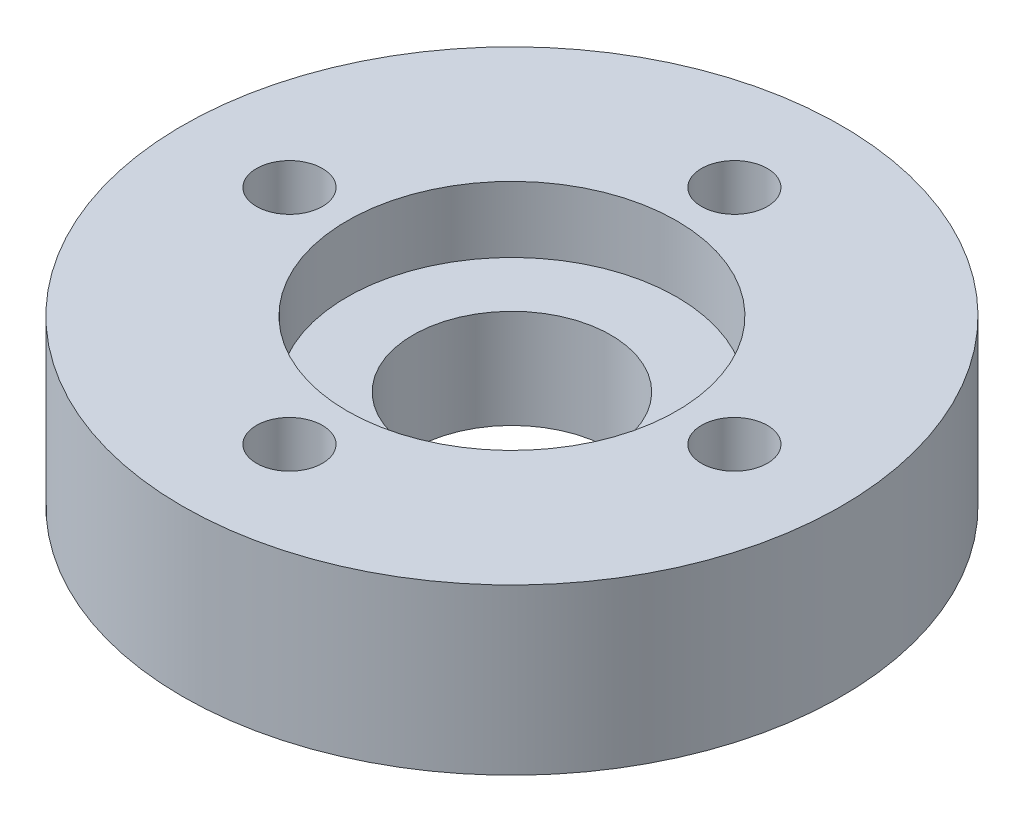
from build123d import *

# Parameters (mm, degrees)
SKETCH1_R           = 5
SKETCH1_R_2         = 3
BOSS_EXTRUDE1_DEPTH = 3
SKETCH1_3_R         = 10
SKETCH1_3_R_2       = 5
BOSS_EXTRUDE2_DEPTH = 5
BOSS_EXTRUDE3_START = 3
SKETCH1_4_R         = 1
BOSS_EXTRUDE3_DEPTH = 2


with BuildPart() as part:
    # Sketch1 → Boss-Extrude1 (new body)
    with BuildSketch(Plane(origin=(0, 0, 0), x_dir=(1, 0, 0), z_dir=(0, 1, 0))):
        Circle(SKETCH1_R)
        Circle(SKETCH1_R_2, mode=Mode.SUBTRACT)
    extrude(amount=BOSS_EXTRUDE1_DEPTH)

    # Sketch1<3> → Boss-Extrude2 (add)
    with BuildSketch(Plane(origin=(0, 0, 0), x_dir=(1, 0, 0), z_dir=(0, 1, 0))):
        Circle(SKETCH1_3_R)
        Polygon((0.866025404, -5.25), (1.732050808, -6.75), (0.866025404, -8.25), (-0.866025404, -8.25), (-1.732050808, -6.75), (-0.866025404, -5.25), align=None, mode=Mode.SUBTRACT)
        Polygon((-5.25, -0.866025404), (-6.75, -1.732050808), (-8.25, -0.866025404), (-8.25, 0.866025404), (-6.75, 1.732050808), (-5.25, 0.866025404), align=None, mode=Mode.SUBTRACT)
        Circle(SKETCH1_3_R_2, mode=Mode.SUBTRACT)
        Polygon((7.92546773, 1.045127089), (8.242840474, -0.495421371), (7.067372744, -1.54054846), (5.57453227, -1.045127089), (5.257159526, 0.495421371), (6.432627256, 1.54054846), align=None, mode=Mode.SUBTRACT)
        Polygon((0.866025404, 8.25), (1.732050808, 6.75), (0.866025404, 5.25), (-0.866025404, 5.25), (-1.732050808, 6.75), (-0.866025404, 8.25), align=None, mode=Mode.SUBTRACT)
    extrude(amount=BOSS_EXTRUDE2_DEPTH)

    # Sketch1<4> → Boss-Extrude3 (add)
    # profile 1 of 4: a face of its own
    with BuildSketch(Plane(origin=(0, 0, 0), x_dir=(1, 0, 0), z_dir=(0, 1, 0)).offset(BOSS_EXTRUDE3_START)):
        Polygon((-8.25, -0.866025404), (-6.75, -1.732050808), (-5.25, -0.866025404), (-5.25, 0.866025404), (-6.75, 1.732050808), (-8.25, 0.866025404), align=None)
        with Locations((-6.75, 0)):
            Circle(SKETCH1_4_R, mode=Mode.SUBTRACT)
    # profile 2 of 4: a face of its own
    with BuildSketch(Plane(origin=(0, 0, 0), x_dir=(1, 0, 0), z_dir=(0, 1, 0)).offset(BOSS_EXTRUDE3_START)):
        Polygon((0.866025404, 5.25), (1.732050808, 6.75), (0.866025404, 8.25), (-0.866025404, 8.25), (-1.732050808, 6.75), (-0.866025404, 5.25), align=None)
        with Locations((0, 6.75)):
            Circle(SKETCH1_4_R, mode=Mode.SUBTRACT)
    # profile 3 of 4: a face of its own
    with BuildSketch(Plane(origin=(0, 0, 0), x_dir=(1, 0, 0), z_dir=(0, 1, 0)).offset(BOSS_EXTRUDE3_START)):
        Polygon((7.067372744, -1.54054846), (8.242840474, -0.495421371), (7.92546773, 1.045127089), (6.432627256, 1.54054846), (5.257159526, 0.495421371), (5.57453227, -1.045127089), align=None)
        with Locations((6.75, 0)):
            Circle(SKETCH1_4_R, mode=Mode.SUBTRACT)
    # profile 4 of 4: a face of its own
    with BuildSketch(Plane(origin=(0, 0, 0), x_dir=(1, 0, 0), z_dir=(0, 1, 0)).offset(BOSS_EXTRUDE3_START)):
        Polygon((0.866025404, -8.25), (1.732050808, -6.75), (0.866025404, -5.25), (-0.866025404, -5.25), (-1.732050808, -6.75), (-0.866025404, -8.25), align=None)
        with Locations((0, -6.75)):
            Circle(SKETCH1_4_R, mode=Mode.SUBTRACT)
    extrude(amount=BOSS_EXTRUDE3_DEPTH)


solid = part.part
